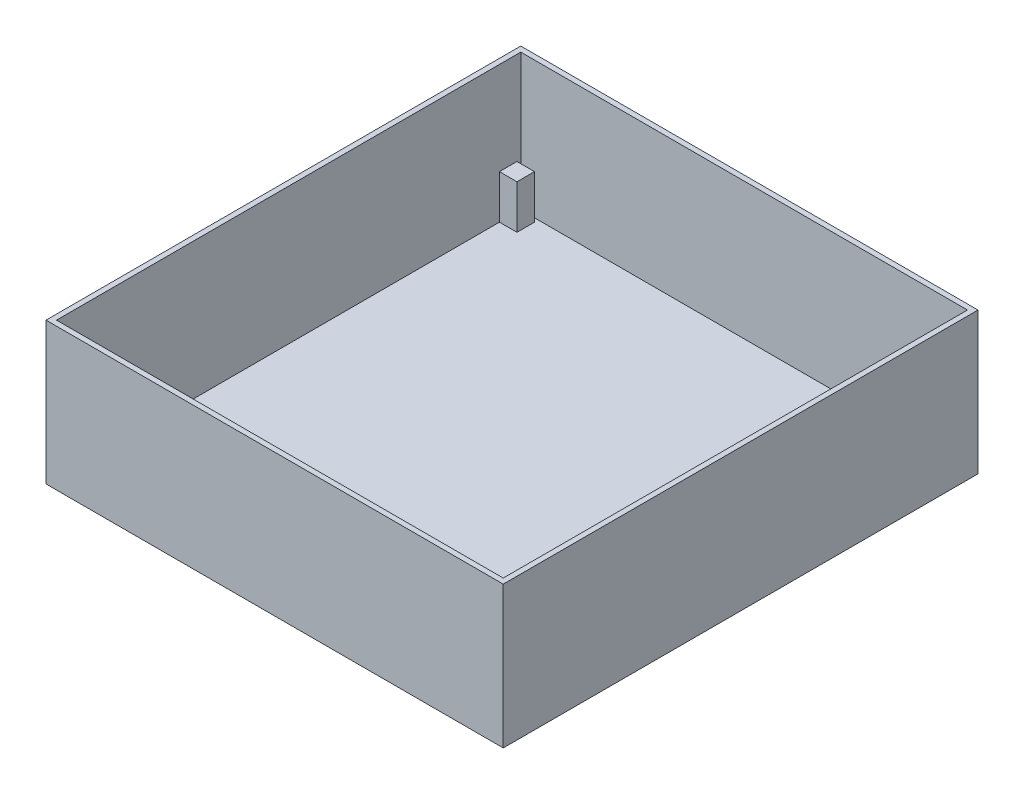
from build123d import *

# Parameters (mm, degrees)
SKETCH_1_W          = 104.4
SKETCH_1_H          = 108.4
EXTRUDE_1_DEPTH     = 32.4
SKETCH_2_W          = 102
SKETCH_2_H          = 106
CUT_EXTRUDE_1_DEPTH = 31.2
EXTRUDE_2_DEPTH     = 10
SKETCH_6_W          = 4
SKETCH_6_H          = 4
EXTRUDE_3_DEPTH     = 10
SKETCH_7_W          = 4
SKETCH_7_H          = 4
EXTRUDE_4_DEPTH     = 10
SKETCH_10_W         = 4
SKETCH_10_H         = 4
EXTRUDE_5_DEPTH     = 10


with BuildPart() as part:
    # 草图1 → 凸台-拉伸1 (new body)
    with BuildSketch(Plane(origin=(0, 0, 0), x_dir=(1, 0, 0), z_dir=(0, 1, 0))):
        Rectangle(SKETCH_1_W, SKETCH_1_H)
    extrude(amount=EXTRUDE_1_DEPTH)

    # 草图2 → 切除-拉伸1 (cut)
    with BuildSketch(Plane(origin=(0, 32.4, 0), x_dir=(1, 0, 0), z_dir=(0, 1, 0))):
        Rectangle(SKETCH_2_W, SKETCH_2_H)
    extrude(amount=-CUT_EXTRUDE_1_DEPTH, mode=Mode.SUBTRACT)

    # 草图3 → 凸台-拉伸2 (add)
    with BuildSketch(Plane(origin=(0, 1.2, 0), x_dir=(1, 0, 0), z_dir=(0, 1, 0))):
        Polygon((48, -53), (51, -53), (51, -52.54057914), (51, -50), (48, -50), align=None)
    extrude(amount=EXTRUDE_2_DEPTH)

    # 草图6 → 凸台-拉伸3 (add)
    with BuildSketch(Plane(origin=(0, 1.2, 0), x_dir=(1, 0, 0), z_dir=(0, 1, 0))):
        with Locations((49, 51)):
            Rectangle(SKETCH_6_W, SKETCH_6_H)
    extrude(amount=EXTRUDE_3_DEPTH)

    # 草图7 → 凸台-拉伸4 (add)
    with BuildSketch(Plane(origin=(0, 1.2, 0), x_dir=(1, 0, 0), z_dir=(0, 1, 0))):
        with Locations((-49, -51)):
            Rectangle(SKETCH_7_W, SKETCH_7_H)
    extrude(amount=EXTRUDE_4_DEPTH)

    # 草图10 → 凸台-拉伸5 (add)
    with BuildSketch(Plane(origin=(0, 1.2, 0), x_dir=(1, 0, 0), z_dir=(0, 1, 0))):
        with Locations((-49, 50.130572063)):
            Rectangle(SKETCH_10_W, SKETCH_10_H)
    extrude(amount=EXTRUDE_5_DEPTH)


solid = part.part
